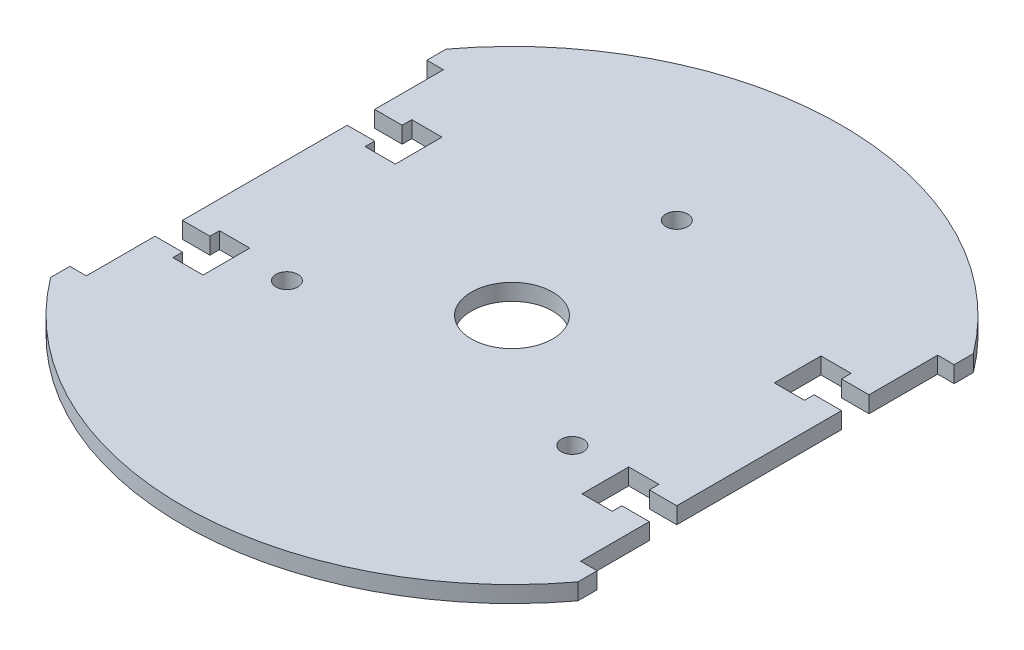
from build123d import *

# Parameters (mm, degrees)
SKETCH1_R           = 60
BOSS_EXTRUDE1_DEPTH = 3
SKETCH2_R           = 7.4
CUT_EXTRUDE3_DEPTH  = 85.905830189
CUT_EXTRUDE1_START  = -3
CUT_EXTRUDE1_DEPTH  = 3
CUT_EXTRUDE2_DEPTH  = 3
SKETCH6_R           = 2
CUT_EXTRUDE4_DEPTH  = 77.896033708


with BuildPart() as part:
    # Sketch1 → Boss-Extrude1 (new body)
    with BuildSketch(Plane(origin=(0, 0, 0), x_dir=(1, 0, 0), z_dir=(0, 1, 0))):
        Circle(SKETCH1_R)
    extrude(amount=BOSS_EXTRUDE1_DEPTH)

    # Sketch2 → Cut-Extrude3 (cut, through all)
    with BuildSketch(Plane(origin=(0, 3, 0), x_dir=(1, 0, 0), z_dir=(0, 1, 0))):
        Circle(SKETCH2_R)
    extrude(amount=-CUT_EXTRUDE3_DEPTH, mode=Mode.SUBTRACT)

    # Sketch3 → Cut-Extrude1 (cut)
    with BuildSketch(Plane(origin=(0, 3, 0), x_dir=(1, 0, 0), z_dir=(0, 1, 0)).offset(CUT_EXTRUDE1_START)):
        with BuildLine():
            Line((-48, 32.5), (-48, 36))
            ThreePointArc((-48, 36), (-60, 0), (-48, -36))
            Line((-48, -36), (-48, -32.5))
            Line((-48, -32.5), (-45, -32.5))
            Line((-45, -32.5), (-45, 32.5))
            Line((-45, 32.5), (-48, 32.5))
        make_face()
    cut_extrude1 = extrude(amount=CUT_EXTRUDE1_DEPTH, mode=Mode.SUBTRACT)

    # Sketch4 → Cut-Extrude2 (cut)
    with BuildSketch(Plane(origin=(0, 3, 0), x_dir=(1, 0, 0), z_dir=(0, 1, 0))):
        Polygon((-40, -15), (-45, -15), (-45, -20), (-40, -20), (-40, -21.75), (-34.5, -21.75), (-34.5, -13.25), (-40, -13.25), align=None)
        Polygon((-40, 20), (-45, 20), (-45, 15), (-40, 15), (-40, 13.25), (-34.5, 13.25), (-34.5, 21.75), (-40, 21.75), align=None)
    cut_extrude2 = extrude(amount=-CUT_EXTRUDE2_DEPTH, mode=Mode.SUBTRACT)

    # Mirror1: Cut-Extrude1, Cut-Extrude2 across plane
    add(cut_extrude1.mirror(Plane(origin=(0, 0, 0), x_dir=(0, 0, 1), z_dir=(1, 0, 0))), mode=Mode.SUBTRACT)
    add(cut_extrude2.mirror(Plane(origin=(0, 0, 0), x_dir=(0, 0, 1), z_dir=(1, 0, 0))), mode=Mode.SUBTRACT)

    # Sketch6 → Cut-Extrude4 (cut, through all)
    with BuildSketch(Plane(origin=(0, 3, 0), x_dir=(1, 0, 0), z_dir=(0, 1, 0))):
        with Locations((25.980762114, -15)):
            Circle(SKETCH6_R)
        with Locations((-25.980762114, -15)):
            Circle(SKETCH6_R)
        with Locations((0, 30)):
            Circle(SKETCH6_R)
    extrude(amount=-CUT_EXTRUDE4_DEPTH, mode=Mode.SUBTRACT)


solid = part.part
